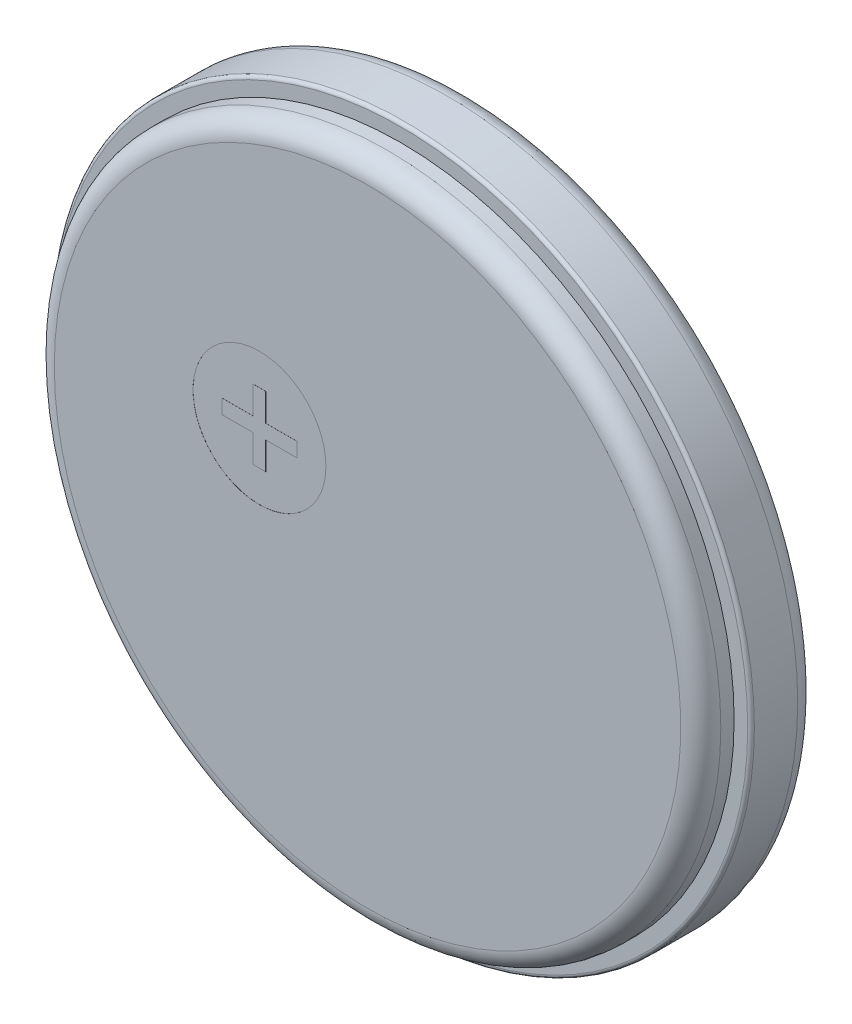
from build123d import *

# Parameters (mm, degrees)
SKETCH2_R           = 5
BOSS_EXTRUDE1_DEPTH = 0.5
FILLET1_R           = 0.3
SKETCH3_R           = 5.254
BOSS_EXTRUDE2_DEPTH = 1
FILLET2_R           = 0.3
FILLET3_R           = 0.05
SKETCH4_R           = 0.204240361
SKETCH4_W           = 0.21654249
SKETCH4_H           = 0.108271245
SKETCH4_H_2         = 0.688998832
SKETCH4_H_3         = 0.836641439
CUT_EXTRUDE1_DEPTH  = 0.001
CUT_EXTRUDE2_DEPTH  = 0.001
CUT_EXTRUDE3_DEPTH  = 0.001
SKETCH7_R           = 0.869118322
SKETCH7_W           = 1.218781041
SKETCH7_H           = 0.198406216
CUT_EXTRUDE4_DEPTH  = 0.001
SKETCH8_R           = 0.996942115
CUT_EXTRUDE5_DEPTH  = 0.001


with BuildPart() as part:
    # Sketch2 → Boss-Extrude1 (new body)
    with BuildSketch(Plane(origin=(0, 0, 10.668), x_dir=(-1, 0, 0), z_dir=(0, 0, -1))):
        with Locations((0, 31.75)):
            Circle(SKETCH2_R)
    extrude(amount=BOSS_EXTRUDE1_DEPTH)

    # Fillet1
    fillet1_edges = [part.edges().sort_by_distance(p)[0] for p in [
        (5, 31.75, 10.668),
    ]]
    fillet(fillet1_edges, radius=FILLET1_R)

    # Sketch3 → Boss-Extrude2 (add)
    with BuildSketch(Plane(origin=(0, 0, 10.168), x_dir=(-1, 0, 0), z_dir=(0, 0, -1))):
        with Locations((0, 31.75)):
            Circle(SKETCH3_R)
    extrude(amount=BOSS_EXTRUDE2_DEPTH)

    # Fillet2
    fillet2_edges = [part.edges().sort_by_distance(p)[0] for p in [
        (5.254, 31.75, 9.168),
    ]]
    fillet(fillet2_edges, radius=FILLET2_R)

    # Fillet3
    fillet3_edges = [part.edges().sort_by_distance(p)[0] for p in [
        (5.254, 31.75, 10.168),
    ]]
    fillet(fillet3_edges, radius=FILLET3_R)

    # Sketch4 → Cut-Extrude1 (cut)
    # profile 1 of 13: a face of its own
    with BuildSketch(Plane(origin=(0, 0, 9.168), x_dir=(-1, 0, 0), z_dir=(0, 0, -1))):
        with BuildLine():
            Line((1.141667618, 31.929914587), (0.581046776, 33.556913753))
            Line((0.581046776, 33.556913753), (0.722765501, 33.641944989))
            Line((0.722765501, 33.641944989), (1.648940943, 32.100139451))
            ThreePointArc((1.648940943, 32.100139451), (1.701014551, 32.132455468), (1.751501604, 32.167197993))
            Line((1.751501604, 32.167197993), (0.824646579, 33.71195637))
            Line((0.824646579, 33.71195637), (0.940237663, 33.78131102))
            Line((0.940237663, 33.78131102), (2.156604635, 32.649157947))
            ThreePointArc((2.156604635, 32.649157947), (0.24295512, 34.273823138), (1.141667618, 31.929914587))
        make_face()
        with Locations((0.581046776, 33.946951852)):
            Circle(SKETCH4_R, mode=Mode.SUBTRACT)
    # profile 2 of 13: a face of its own
    with BuildSketch(Plane(origin=(0, 0, 9.168), x_dir=(-1, 0, 0), z_dir=(0, 0, -1))):
        Polygon((-2.39422632, 30.765555813), (-2.39422632, 30.096242662), (-2.256426553, 30.096242662), (-2.256426553, 29.928914374), (-2.61076881, 29.928914374), (-2.61076881, 30.765555813), align=None)
    # profile 3 of 13: a face of its own
    with BuildSketch(Plane(origin=(0, 0, 9.168), x_dir=(-1, 0, 0), z_dir=(0, 0, -1))):
        with Locations((-2.098941106, 30.711420191)):
            Rectangle(SKETCH4_W, SKETCH4_H)
    # profile 4 of 13: a face of its own
    with BuildSketch(Plane(origin=(0, 0, 9.168), x_dir=(-1, 0, 0), z_dir=(0, 0, -1))):
        with Locations((-2.098941106, 30.27341379)):
            Rectangle(SKETCH4_W, SKETCH4_H_2)
    # profile 5 of 13: a face of its own
    with BuildSketch(Plane(origin=(0, 0, 9.168), x_dir=(-1, 0, 0), z_dir=(0, 0, -1))):
        with BuildLine():
            Line((-1.705227488, 30.70649877), (-1.705227488, 30.598227525))
            Line((-1.705227488, 30.598227525), (-1.636327605, 30.598227525))
            Line((-1.636327605, 30.598227525), (-1.636327605, 30.48995628))
            Line((-1.636327605, 30.48995628), (-1.705227488, 30.48995628))
            Line((-1.705227488, 30.48995628), (-1.705227488, 30.120849763))
            add(Edge.make_bspline(
                [(-1.705227488, 30.120849763), (-1.705179946, 30.115467168), (-1.705090741, 30.105367494), (-1.704909922, 30.091155884), (-1.704087812, 30.078851278), (-1.703150674, 30.068396215), (-1.702277967, 30.059770586), (-1.700674851, 30.053101016), (-1.699157307, 30.048205365), (-1.696998436, 30.044674265), (-1.693454652, 30.042695286), (-1.688757018, 30.041258916), (-1.682390647, 30.040120138), (-1.674436337, 30.039080915), (-1.664796502, 30.03813274), (-1.653507552, 30.037569394), (-1.640532618, 30.037303378), (-1.63135503, 30.037226445), (-1.626484764, 30.037185619)],
                knots=[0, 0, 0, 0, 1.739732428, 3.26436042, 4.592396978, 5.723406921, 6.6584426, 7.389883741, 7.934871935, 8.316298907, 8.688621296, 9.212551535, 9.90465525, 10.773969042, 11.805991926, 13.033823307, 14.425940557, 16, 16, 16, 16], degree=3))
            Line((-1.626484764, 30.037185619), (-1.626484764, 29.928914374))
            Line((-1.626484764, 29.928914374), (-1.714147562, 29.928914374))
            add(Edge.make_bspline(
                [(-1.714147562, 29.928914374), (-1.72009423, 29.928971109), (-1.731577482, 29.929080666), (-1.748138827, 29.929150415), (-1.763370933, 29.929581791), (-1.777255569, 29.930439398), (-1.789822074, 29.931151303), (-1.801116377, 29.932016366), (-1.811058854, 29.9332737), (-1.822495018, 29.935009102), (-1.835493184, 29.938426395), (-1.85011095, 29.944210693), (-1.863596403, 29.952283918), (-1.876146609, 29.961774326), (-1.886897812, 29.972882532), (-1.895755352, 29.984894046), (-1.902248806, 29.997727769), (-1.905940717, 30.009424757), (-1.907615621, 30.020190071), (-1.908882617, 30.030596118), (-1.909706319, 30.043381788), (-1.910418778, 30.058509911), (-1.91126972, 30.075934347), (-1.911694009, 30.095676678), (-1.911762064, 30.117773942), (-1.911870326, 30.133307142), (-1.911927137, 30.14145821)],
                knots=[0, 0, 0, 0, 1.195583195, 2.308718731, 3.329517598, 4.258521121, 5.105212991, 5.860114927, 6.535083728, 7.11964657, 8.184549345, 9.22951552, 10.268875888, 11.334626177, 12.384156653, 13.365429045, 14.324142953, 15.262984696, 15.817041888, 16.512473617, 17.370134424, 18.391765408, 19.557524602, 20.877102082, 22.361254963, 24, 24, 24, 24], degree=3))
            Line((-1.911927137, 30.14145821), (-1.911927137, 30.48995628))
            Line((-1.911927137, 30.48995628), (-1.951298499, 30.48995628))
            Line((-1.951298499, 30.48995628), (-1.951298499, 30.598227525))
            Line((-1.951298499, 30.598227525), (-1.911927137, 30.598227525))
            Line((-1.911927137, 30.598227525), (-1.911927137, 30.70649877))
            Line((-1.911927137, 30.70649877), (-1.705227488, 30.70649877))
        make_face()
    # profile 6 of 13: a face of its own
    with BuildSketch(Plane(origin=(0, 0, 9.168), x_dir=(-1, 0, 0), z_dir=(0, 0, -1))):
        with BuildLine():
            Line((-1.380413753, 30.765555813), (-1.380413753, 30.5770039))
            add(Edge.make_bspline(
                [(-1.380413753, 30.5770039), (-1.375866986, 30.58103327), (-1.366920207, 30.588961955), (-1.352499473, 30.599306103), (-1.337600849, 30.608122589), (-1.322073804, 30.615242258), (-1.306004962, 30.620817862), (-1.289362597, 30.624768391), (-1.272173261, 30.627374489), (-1.260515026, 30.627627761), (-1.254609948, 30.627756047)],
                knots=[0, 0, 0, 0, 1.04812943, 2.062428872, 3.058027074, 4.032076938, 5.005966002, 5.988978722, 6.981386338, 8, 8, 8, 8], degree=3))
            add(Edge.make_bspline(
                [(-1.254609948, 30.627756047), (-1.245712064, 30.627469604), (-1.228468331, 30.626914489), (-1.203660069, 30.621515584), (-1.180868884, 30.612800219), (-1.160778627, 30.600363838), (-1.143348244, 30.586202798), (-1.129366108, 30.570487245), (-1.119036955, 30.553670405), (-1.113774272, 30.538311181), (-1.111271581, 30.524852925), (-1.109353584, 30.51291951), (-1.108135402, 30.499038926), (-1.106824986, 30.483359526), (-1.106010198, 30.465762935), (-1.105134333, 30.446286808), (-1.10495573, 30.424901247), (-1.104862672, 30.410034264), (-1.10481422, 30.402293482)],
                knots=[0, 0, 0, 0, 1.355316654, 2.626548085, 3.851945391, 5.058719203, 6.213940796, 7.266439573, 8.251962698, 9.203916533, 9.722177574, 10.339188478, 11.046355066, 11.846282136, 12.738814704, 13.732522223, 14.819393942, 16, 16, 16, 16], degree=3))
            Line((-1.10481422, 30.402293482), (-1.10481422, 29.928914374))
            Line((-1.10481422, 29.928914374), (-1.311513869, 29.928914374))
            Line((-1.311513869, 29.928914374), (-1.311513869, 30.414904622))
            add(Edge.make_bspline(
                [(-1.311513869, 30.414904622), (-1.31155281, 30.41972364), (-1.311626971, 30.42890124), (-1.311923704, 30.441975906), (-1.312400337, 30.453715707), (-1.312921257, 30.464085713), (-1.3138841, 30.473108475), (-1.314934401, 30.480753377), (-1.316066566, 30.487113393), (-1.31804471, 30.493552268), (-1.321455262, 30.500113439), (-1.327863644, 30.505871054), (-1.336353666, 30.509166523), (-1.34260105, 30.509475597), (-1.345963811, 30.509641961)],
                knots=[0, 0, 0, 0, 1.530393892, 2.91456541, 4.152798705, 5.261743141, 6.211014231, 7.0329459, 7.713007905, 8.258808434, 9.169608314, 10.022710515, 10.935690215, 12, 12, 12, 12], degree=3))
            add(Edge.make_bspline(
                [(-1.345963811, 30.509641961), (-1.34913618, 30.509497046), (-1.355083694, 30.509225362), (-1.363111969, 30.505516186), (-1.369557772, 30.499829575), (-1.374056637, 30.491245107), (-1.3769267, 30.479600259), (-1.378870351, 30.464122704), (-1.380233928, 30.444353893), (-1.380349921, 30.429723086), (-1.380413753, 30.421671574)],
                knots=[0, 0, 0, 0, 0.714705951, 1.339921301, 1.966327435, 2.633377295, 3.503197372, 4.678559347, 6.172170647, 8, 8, 8, 8], degree=3))
            Line((-1.380413753, 30.421671574), (-1.380413753, 29.928914374))
            Line((-1.380413753, 29.928914374), (-1.587113402, 29.928914374))
            Line((-1.587113402, 29.928914374), (-1.587113402, 30.765555813))
            Line((-1.587113402, 30.765555813), (-1.380413753, 30.765555813))
        make_face()
    # profile 7 of 13: a face of its own
    with BuildSketch(Plane(origin=(0, 0, 9.168), x_dir=(-1, 0, 0), z_dir=(0, 0, -1))):
        with Locations((-0.917800251, 30.711420191)):
            Rectangle(SKETCH4_W, SKETCH4_H)
    # profile 8 of 13: a face of its own
    with BuildSketch(Plane(origin=(0, 0, 9.168), x_dir=(-1, 0, 0), z_dir=(0, 0, -1))):
        with Locations((-0.917800251, 30.27341379)):
            Rectangle(SKETCH4_W, SKETCH4_H_2)
    # profile 9 of 13: a face of its own
    with BuildSketch(Plane(origin=(0, 0, 9.168), x_dir=(-1, 0, 0), z_dir=(0, 0, -1))):
        with BuildLine():
            Line((-0.258329941, 30.617913206), (-0.258329941, 29.928914374))
            Line((-0.258329941, 29.928914374), (-0.468413067, 29.928914374))
            Line((-0.468413067, 29.928914374), (-0.46502959, 29.987817622))
            add(Edge.make_bspline(
                [(-0.46502959, 29.987817622), (-0.468628797, 29.982326947), (-0.475635823, 29.971637562), (-0.488351696, 29.957701636), (-0.502054709, 29.945703135), (-0.517098165, 29.93597093), (-0.533274694, 29.928318416), (-0.550671663, 29.92295733), (-0.569228033, 29.919654867), (-0.582001857, 29.919268753), (-0.588526479, 29.919071534)],
                knots=[0, 0, 0, 0, 1.061666706, 2.066879479, 3.043894156, 4.004116477, 4.958543322, 5.932696836, 6.944061519, 8, 8, 8, 8], degree=3))
            add(Edge.make_bspline(
                [(-0.588526479, 29.919071534), (-0.59587025, 29.919267939), (-0.609960643, 29.919644778), (-0.63012982, 29.922784035), (-0.648466538, 29.927700008), (-0.664693782, 29.935049779), (-0.679034188, 29.943901503), (-0.691012651, 29.954625908), (-0.701673375, 29.966098875), (-0.709629949, 29.979358119), (-0.716091944, 29.993227245), (-0.721067036, 30.007491681), (-0.725049605, 30.021952578), (-0.727146451, 30.034514519), (-0.728079986, 30.045690626), (-0.728876195, 30.055888185), (-0.729469353, 30.067939978), (-0.729873988, 30.08178561), (-0.730386723, 30.097470289), (-0.730663226, 30.115004648), (-0.730821884, 30.134383356), (-0.730798504, 30.147917537), (-0.730786283, 30.154992116)],
                knots=[0, 0, 0, 0, 1.372356562, 2.633121929, 3.807600132, 4.910298633, 5.952776581, 6.944670893, 7.908661259, 8.868831557, 9.820833315, 10.766735229, 11.689826756, 12.622720248, 13.142547126, 13.786556214, 14.535201573, 15.398368654, 16.376504451, 17.469410664, 18.677211821, 20, 20, 20, 20], degree=3))
            Line((-0.730786283, 30.154992116), (-0.730786283, 30.617913206))
            Line((-0.730786283, 30.617913206), (-0.524086633, 30.617913206))
            Line((-0.524086633, 30.617913206), (-0.524086633, 30.148071369))
            add(Edge.make_bspline(
                [(-0.524086633, 30.148071369), (-0.524119821, 30.141662956), (-0.524182486, 30.129562949), (-0.5237688, 30.112442446), (-0.523536765, 30.097418667), (-0.523076022, 30.084446725), (-0.522489012, 30.073521781), (-0.521746328, 30.064595951), (-0.520897928, 30.057698587), (-0.519602038, 30.051423795), (-0.516907122, 30.04541806), (-0.511133599, 30.040534885), (-0.503591336, 30.037541337), (-0.497922146, 30.037310221), (-0.4948657, 30.037185619)],
                knots=[0, 0, 0, 0, 1.812042913, 3.421398194, 4.842335651, 6.06080483, 7.091677302, 7.935583642, 8.593692084, 9.054393081, 9.748100288, 10.405409957, 11.140304508, 12, 12, 12, 12], degree=3))
            add(Edge.make_bspline(
                [(-0.4948657, 30.037185619), (-0.491609769, 30.037308768), (-0.485649969, 30.037534186), (-0.477622144, 30.040464767), (-0.471783831, 30.045669516), (-0.469107039, 30.051937073), (-0.468165379, 30.058445764), (-0.467125373, 30.06560699), (-0.466713725, 30.074969482), (-0.466012762, 30.086443648), (-0.465588414, 30.100085474), (-0.465343946, 30.115876881), (-0.464935311, 30.133869379), (-0.464997004, 30.146584425), (-0.46502959, 30.153300378)],
                knots=[0, 0, 0, 0, 0.876067957, 1.603593713, 2.260088472, 2.929160625, 3.393475713, 4.035657034, 4.88190587, 5.921621531, 7.140530935, 8.566649448, 10.186540624, 12, 12, 12, 12], degree=3))
            Line((-0.46502959, 30.153300378), (-0.46502959, 30.617913206))
            Line((-0.46502959, 30.617913206), (-0.258329941, 30.617913206))
        make_face()
    # profile 10 of 13: a face of its own
    with BuildSketch(Plane(origin=(0, 0, 9.168), x_dir=(-1, 0, 0), z_dir=(0, 0, -1))):
        with BuildLine():
            Line((0.017269592, 30.617913206), (0.017269592, 30.550858855))
            add(Edge.make_bspline(
                [(0.017269592, 30.550858855), (0.02142732, 30.556972329), (0.029569613, 30.56894466), (0.04400058, 30.584536608), (0.059300259, 30.598105668), (0.076083654, 30.608841528), (0.093907104, 30.617471146), (0.113024301, 30.623456283), (0.133300538, 30.627043577), (0.147211064, 30.627515524), (0.154300387, 30.627756047)],
                knots=[0, 0, 0, 0, 1.077223304, 2.1095822, 3.090370703, 4.052939172, 5.006340392, 5.971404446, 6.966152131, 8, 8, 8, 8], degree=3))
            add(Edge.make_bspline(
                [(0.154300387, 30.627756047), (0.161236005, 30.627515186), (0.174841235, 30.627042703), (0.194664193, 30.623462199), (0.213355318, 30.617432878), (0.230841497, 30.608847251), (0.247316533, 30.598044533), (0.26245744, 30.584585778), (0.276561416, 30.568880216), (0.284600289, 30.556961802), (0.288716677, 30.550858855)],
                knots=[0, 0, 0, 0, 1.025789608, 2.012236342, 2.969316882, 3.922572519, 4.886093681, 5.875074288, 6.911909806, 8, 8, 8, 8], degree=3))
            add(Edge.make_bspline(
                [(0.288716677, 30.550858855), (0.293217133, 30.556947669), (0.301967336, 30.568786104), (0.316642032, 30.584590133), (0.332223628, 30.597920789), (0.34870169, 30.608819688), (0.366072746, 30.617438374), (0.384471522, 30.623393244), (0.403764495, 30.627044768), (0.416913771, 30.62751642), (0.42359435, 30.627756047)],
                knots=[0, 0, 0, 0, 1.121403297, 2.180336103, 3.188108587, 4.153139269, 5.101063311, 6.052421157, 7.010519338, 8, 8, 8, 8], degree=3))
            add(Edge.make_bspline(
                [(0.42359435, 30.627756047), (0.432233837, 30.627510956), (0.44894773, 30.627036804), (0.472744404, 30.621993074), (0.494358112, 30.614018889), (0.513192729, 30.602545562), (0.529299672, 30.588916491), (0.542556142, 30.573691597), (0.552351077, 30.556802505), (0.558013586, 30.541453143), (0.560949123, 30.527995707), (0.562898402, 30.516385066), (0.564805292, 30.503376007), (0.566102589, 30.488843372), (0.567177395, 30.472896165), (0.56792668, 30.455460926), (0.568388162, 30.436592177), (0.568441204, 30.423517398), (0.568468658, 30.416750154)],
                knots=[0, 0, 0, 0, 1.396274718, 2.701223389, 3.916961255, 5.107873857, 6.249837686, 7.3206937, 8.358018463, 9.39218657, 9.953717558, 10.585231331, 11.297424592, 12.080859583, 12.945645179, 13.884064098, 14.904833943, 16, 16, 16, 16], degree=3))
            Line((0.568468658, 30.416750154), (0.568468658, 29.928914374))
            Line((0.568468658, 29.928914374), (0.361769008, 29.928914374))
            Line((0.361769008, 29.928914374), (0.361769008, 30.379070531))
            add(Edge.make_bspline(
                [(0.361769008, 30.379070531), (0.361712671, 30.3860938), (0.361605754, 30.399422674), (0.361531588, 30.418392724), (0.361123017, 30.435266467), (0.360246192, 30.450021126), (0.359626412, 30.462653649), (0.358512604, 30.473162118), (0.357360701, 30.481595953), (0.355661843, 30.489752012), (0.352620227, 30.497784867), (0.346340713, 30.504845784), (0.33777159, 30.5089662), (0.331467331, 30.509406139), (0.328088038, 30.509641961)],
                knots=[0, 0, 0, 0, 1.713054107, 3.251061448, 4.626981132, 5.828964419, 6.856173046, 7.710918569, 8.405859511, 8.930717602, 9.743458848, 10.46932057, 11.179504966, 12, 12, 12, 12], degree=3))
            add(Edge.make_bspline(
                [(0.328088038, 30.509641961), (0.324648628, 30.509481049), (0.318155182, 30.509177256), (0.309503067, 30.5048205), (0.302739432, 30.498003176), (0.299486259, 30.489923506), (0.297540893, 30.481823788), (0.296468141, 30.4733557), (0.295103979, 30.462871745), (0.294569695, 30.450172241), (0.293651042, 30.435421268), (0.293311115, 30.418545024), (0.292970761, 30.399526653), (0.292904276, 30.386145349), (0.292869125, 30.379070531)],
                knots=[0, 0, 0, 0, 0.826216397, 1.559858194, 2.289277558, 3.106944553, 3.631407287, 4.309815047, 5.173054605, 6.193999705, 7.388653756, 8.756183606, 10.284964305, 12, 12, 12, 12], degree=3))
            Line((0.292869125, 30.379070531), (0.292869125, 29.928914374))
            Line((0.292869125, 29.928914374), (0.086169475, 29.928914374))
            Line((0.086169475, 29.928914374), (0.086169475, 30.367535952))
            add(Edge.make_bspline(
                [(0.086169475, 30.367535952), (0.086108595, 30.375584355), (0.085993426, 30.390809716), (0.085976505, 30.412396086), (0.085391851, 30.431411882), (0.085055642, 30.447926704), (0.084300552, 30.461877629), (0.0833083, 30.473296723), (0.082575935, 30.482218301), (0.081023628, 30.490394499), (0.078286747, 30.498299372), (0.071968591, 30.505071801), (0.063407139, 30.509147722), (0.056996928, 30.509469623), (0.053565066, 30.509641961)],
                knots=[0, 0, 0, 0, 1.818527428, 3.440152716, 4.876833041, 6.116673496, 7.172292882, 8.032228621, 8.707612752, 9.19146093, 9.91415351, 10.561648488, 11.229943611, 12, 12, 12, 12], degree=3))
            add(Edge.make_bspline(
                [(0.053565066, 30.509641961), (0.051292937, 30.509541013), (0.046808839, 30.50934179), (0.04035612, 30.507213169), (0.034389561, 30.503803944), (0.029322904, 30.498954213), (0.024708551, 30.493511959), (0.021613788, 30.487057202), (0.019123064, 30.480234219), (0.018160097, 30.4720876), (0.017822154, 30.461664504), (0.017550384, 30.44750847), (0.017170882, 30.429055741), (0.01723456, 30.415263897), (0.017269592, 30.407676286)],
                knots=[0, 0, 0, 0, 0.672379664, 1.326956341, 1.99518974, 2.695410677, 3.398931448, 4.099978799, 4.807439054, 5.545658748, 6.520718531, 7.90594544, 9.747647403, 12, 12, 12, 12], degree=3))
            Line((0.017269592, 30.407676286), (0.017269592, 29.928914374))
            Line((0.017269592, 29.928914374), (-0.189430057, 29.928914374))
            Line((-0.189430057, 29.928914374), (-0.189430057, 30.617913206))
            Line((-0.189430057, 30.617913206), (0.017269592, 30.617913206))
        make_face()
    # profile 11 of 13: a face of its own
    with BuildSketch(Plane(origin=(0, 0, 9.168), x_dir=(-1, 0, 0), z_dir=(0, 0, -1))):
        with Locations((0.932653755, 30.347235094)):
            Rectangle(SKETCH4_W, SKETCH4_H_3)
    # profile 12 of 13: a face of its own
    with BuildSketch(Plane(origin=(0, 0, 9.168), x_dir=(-1, 0, 0), z_dir=(0, 0, -1))):
        with BuildLine():
            Line((1.582281225, 30.375225671), (1.582281225, 30.207743589))
            add(Edge.make_bspline(
                [(1.582281225, 30.207743589), (1.58226032, 30.200309678), (1.582219949, 30.185952995), (1.58167013, 30.165192993), (1.581211324, 30.145954639), (1.580000972, 30.128278378), (1.578935922, 30.112101876), (1.577141504, 30.097506025), (1.575385282, 30.084406879), (1.572542714, 30.06901073), (1.567631516, 30.050997221), (1.559125705, 30.030341455), (1.547673797, 30.010618133), (1.534136685, 29.991583972), (1.518158598, 29.974043053), (1.49958019, 29.959078609), (1.479097827, 29.946259955), (1.4563781, 29.936197823), (1.431725982, 29.928554349), (1.405354567, 29.923095342), (1.377264101, 29.919603981), (1.357957192, 29.91925207), (1.348052381, 29.919071534)],
                knots=[0, 0, 0, 0, 1.030820639, 1.990764312, 2.879836517, 3.698877591, 4.447479564, 5.127340947, 5.737592725, 6.27997261, 7.297519797, 8.320663796, 9.368189507, 10.453252059, 11.55504584, 12.646447391, 13.751149947, 14.896660089, 16.081551939, 17.323827552, 18.627072679, 20, 20, 20, 20], degree=3))
            add(Edge.make_bspline(
                [(1.348052381, 29.919071534), (1.337074262, 29.919217093), (1.315998253, 29.919496541), (1.285675083, 29.922487933), (1.257947025, 29.927163143), (1.232736461, 29.933622718), (1.210228643, 29.942328566), (1.190181329, 29.95266117), (1.172902928, 29.965260191), (1.158211203, 29.979756829), (1.146025445, 29.996173121), (1.135685199, 30.014099178), (1.127236966, 30.033615097), (1.121661277, 30.051089602), (1.11827247, 30.066352418), (1.115927081, 30.0792714), (1.114219596, 30.093615135), (1.11244201, 30.109235238), (1.111229348, 30.126268985), (1.110587524, 30.144634262), (1.109845395, 30.164368084), (1.109831872, 30.177957905), (1.109824883, 30.18498202)],
                knots=[0, 0, 0, 0, 1.566851768, 3.008072865, 4.344862402, 5.578649608, 6.716279408, 7.783554075, 8.789251884, 9.757031178, 10.718730646, 11.699157592, 12.705361265, 13.749293612, 14.312132592, 14.936642054, 15.622938965, 16.373791341, 17.180992382, 18.06001777, 18.997289313, 20, 20, 20, 20], degree=3))
            Line((1.109824883, 30.18498202), (1.109824883, 30.360307616))
            add(Edge.make_bspline(
                [(1.109824883, 30.360307616), (1.10988589, 30.368049085), (1.110004313, 30.383076467), (1.110861722, 30.40498827), (1.112649837, 30.425539572), (1.114652692, 30.444860948), (1.117672056, 30.462789548), (1.120931544, 30.479519909), (1.125111537, 30.494859902), (1.129850925, 30.509098296), (1.135654377, 30.52227237), (1.142184907, 30.53481327), (1.150053227, 30.546509544), (1.158508789, 30.557811222), (1.168425959, 30.568139145), (1.179099269, 30.577982555), (1.190913496, 30.587089332), (1.203614957, 30.595543198), (1.217390625, 30.603132644), (1.232143566, 30.609646294), (1.247699898, 30.615464604), (1.264315933, 30.619836927), (1.281781815, 30.623340961), (1.300206846, 30.625990861), (1.319522346, 30.627530588), (1.332721442, 30.627679996), (1.339439895, 30.627756047)],
                knots=[0, 0, 0, 0, 1.367165939, 2.653879496, 3.871100312, 5.009836591, 6.082946868, 7.080781523, 8.018528806, 8.888869268, 9.728143456, 10.558384481, 11.381984661, 12.214936081, 13.047543032, 13.906222177, 14.777268644, 15.678695825, 16.598484629, 17.550802427, 18.52460938, 19.528259021, 20.581129208, 21.669407874, 22.813708716, 24, 24, 24, 24], degree=3))
            add(Edge.make_bspline(
                [(1.339439895, 30.627756047), (1.350631152, 30.627573692), (1.372219922, 30.627221917), (1.403339055, 30.623015816), (1.432101588, 30.616848477), (1.458177699, 30.607422039), (1.48169365, 30.596317397), (1.502492272, 30.583482802), (1.520617808, 30.569209362), (1.535513719, 30.553025525), (1.547858973, 30.53608327), (1.558375702, 30.518920811), (1.566506003, 30.501355282), (1.571698838, 30.486247226), (1.574755341, 30.473504718), (1.576675416, 30.462860992), (1.578622411, 30.451142831), (1.579906168, 30.438194636), (1.580986159, 30.424093427), (1.581736962, 30.408810719), (1.582199846, 30.392402308), (1.582253535, 30.381070193), (1.582281225, 30.375225671)],
                knots=[0, 0, 0, 0, 1.658815711, 3.199979415, 4.649957207, 6.01364259, 7.3027161, 8.501301308, 9.631864061, 10.713282271, 11.752046223, 12.737947139, 13.693922422, 14.617315316, 15.102372854, 15.636288777, 16.22136206, 16.863764619, 17.565366476, 18.319134645, 19.133096068, 20, 20, 20, 20], degree=3))
        make_face()
        with BuildLine():
            add(Edge.make_bspline(
                [(1.375581575, 30.428746116), (1.375523222, 30.433000887), (1.375412843, 30.441049139), (1.3753639, 30.45253833), (1.374866802, 30.462740607), (1.37426974, 30.471768065), (1.373515385, 30.479512243), (1.372672253, 30.4861109), (1.371415579, 30.491374454), (1.369930492, 30.496745421), (1.366816992, 30.501952314), (1.361561026, 30.506769637), (1.354366931, 30.509102003), (1.349243113, 30.50945433), (1.346514437, 30.509641961)],
                knots=[0, 0, 0, 0, 1.585193112, 2.998524278, 4.279327145, 5.389603052, 6.36823621, 7.178467141, 7.864111684, 8.383615122, 9.248283339, 10.08726259, 10.981376477, 12, 12, 12, 12], degree=3))
            add(Edge.make_bspline(
                [(1.346514437, 30.509641961), (1.343725685, 30.509474323), (1.338582004, 30.509165124), (1.331408735, 30.506639532), (1.325897549, 30.502038903), (1.322710521, 30.496733478), (1.320934789, 30.491410303), (1.319807753, 30.486089312), (1.318659529, 30.479533797), (1.318063037, 30.471756087), (1.317165115, 30.462751111), (1.316765557, 30.452536276), (1.316686324, 30.441049749), (1.316580485, 30.433001098), (1.316524532, 30.428746116)],
                knots=[0, 0, 0, 0, 1.033270833, 1.905804199, 2.770216926, 3.641090693, 4.164334303, 4.847116915, 5.656874259, 6.631422529, 7.738535089, 9.013991789, 10.421423604, 12, 12, 12, 12], degree=3))
            Line((1.316524532, 30.428746116), (1.316524532, 30.116082137))
            add(Edge.make_bspline(
                [(1.316524532, 30.116082137), (1.316532645, 30.10859462), (1.316547328, 30.095042225), (1.317817358, 30.07682083), (1.31941659, 30.06284263), (1.321862487, 30.052590952), (1.325775492, 30.045344105), (1.331291201, 30.040511849), (1.338262856, 30.037614812), (1.343357989, 30.037334101), (1.346053054, 30.037185619)],
                knots=[0, 0, 0, 0, 1.905444241, 3.448851208, 4.646660283, 5.485608871, 6.116872217, 6.708589425, 7.316910003, 8, 8, 8, 8], degree=3))
            add(Edge.make_bspline(
                [(1.346053054, 30.037185619), (1.348842722, 30.037352851), (1.353988093, 30.0376613), (1.361081007, 30.040167377), (1.366537981, 30.044623829), (1.370370315, 30.051311676), (1.372833859, 30.060677046), (1.37447623, 30.073428082), (1.375494035, 30.090023952), (1.375550379, 30.102341545), (1.375581575, 30.10916139)],
                knots=[0, 0, 0, 0, 0.759541473, 1.400927311, 2.016662793, 2.637613118, 3.469132219, 4.641499325, 6.140509111, 8, 8, 8, 8], degree=3))
            Line((1.375581575, 30.10916139), (1.375581575, 30.428746116))
        make_face(mode=Mode.SUBTRACT)
    # profile 13 of 13: a face of its own
    with BuildSketch(Plane(origin=(0, 0, 9.168), x_dir=(-1, 0, 0), z_dir=(0, 0, -1))):
        with BuildLine():
            Line((1.867723598, 30.617913206), (1.867723598, 30.556395453))
            add(Edge.make_bspline(
                [(1.867723598, 30.556395453), (1.871478469, 30.56208945), (1.878795601, 30.573185364), (1.891924728, 30.587727162), (1.906092198, 30.600203554), (1.921673908, 30.610264583), (1.938399477, 30.618233659), (1.956398593, 30.623674909), (1.975546534, 30.627238318), (1.988742923, 30.627580264), (1.99552673, 30.627756047)],
                knots=[0, 0, 0, 0, 1.064995489, 2.075361174, 3.052501998, 4.00840857, 4.965658179, 5.939110672, 6.940568094, 8, 8, 8, 8], degree=3))
            add(Edge.make_bspline(
                [(1.99552673, 30.627756047), (2.003907106, 30.627499491), (2.019996979, 30.627006919), (2.042931452, 30.622187846), (2.063426188, 30.614127565), (2.081389165, 30.603037393), (2.096387001, 30.589345505), (2.109100263, 30.57424137), (2.11814408, 30.556950446), (2.123456093, 30.541302942), (2.126473716, 30.527498898), (2.128208362, 30.515404856), (2.129923793, 30.501773591), (2.131325955, 30.486542836), (2.132130888, 30.46971042), (2.132958114, 30.451258069), (2.13339483, 30.431157621), (2.133451116, 30.417211697), (2.13348029, 30.409983201)],
                knots=[0, 0, 0, 0, 1.346989573, 2.586147466, 3.748680099, 4.874797896, 5.961187435, 7.004645834, 8.034222122, 9.080187704, 9.654551372, 10.305482694, 11.045161036, 11.865103338, 12.765521689, 13.756168348, 14.836970039, 16, 16, 16, 16], degree=3))
            Line((2.13348029, 30.409983201), (2.13348029, 29.928914374))
            Line((2.13348029, 29.928914374), (1.926780641, 29.928914374))
            Line((1.926780641, 29.928914374), (1.926780641, 30.407061108))
            add(Edge.make_bspline(
                [(1.926780641, 30.407061108), (1.926813308, 30.412700592), (1.926875381, 30.423416646), (1.926460727, 30.438639968), (1.926232361, 30.452126598), (1.925759102, 30.463866869), (1.925200903, 30.47387327), (1.924371163, 30.482114593), (1.923754788, 30.488676702), (1.922379503, 30.494844772), (1.919945924, 30.501029724), (1.914444257, 30.506271883), (1.907058012, 30.509281956), (1.901588934, 30.509515743), (1.898636269, 30.509641961)],
                knots=[0, 0, 0, 0, 1.718959462, 3.26633864, 4.641861321, 5.830430957, 6.848101224, 7.695563669, 8.356528148, 8.853158932, 9.622694719, 10.341022558, 11.104345243, 12, 12, 12, 12], degree=3))
            add(Edge.make_bspline(
                [(1.898636269, 30.509641961), (1.895522184, 30.509487757), (1.889686089, 30.509198764), (1.881774701, 30.505638355), (1.875929338, 30.499585453), (1.873033628, 30.492681607), (1.871543883, 30.485692739), (1.870511772, 30.47839238), (1.869581635, 30.469212317), (1.86909497, 30.458120795), (1.868420646, 30.445207629), (1.867942122, 30.430389931), (1.867892594, 30.413674008), (1.867781856, 30.40188326), (1.867723598, 30.395680324)],
                knots=[0, 0, 0, 0, 0.856066547, 1.604351442, 2.335943869, 3.128797032, 3.637596973, 4.311011628, 5.165551894, 6.187484524, 7.379252524, 8.740395611, 10.285171094, 12, 12, 12, 12], degree=3))
            Line((1.867723598, 30.395680324), (1.867723598, 29.928914374))
            Line((1.867723598, 29.928914374), (1.661023948, 29.928914374))
            Line((1.661023948, 29.928914374), (1.661023948, 30.617913206))
            Line((1.661023948, 30.617913206), (1.867723598, 30.617913206))
        make_face()
    extrude(amount=-CUT_EXTRUDE1_DEPTH, mode=Mode.SUBTRACT)

    # Sketch5 → Cut-Extrude2 (cut)
    with BuildSketch(Plane(origin=(0, 0, 9.168), x_dir=(-1, 0, 0), z_dir=(0, 0, -1))):
        Polygon((-0.587410164, 31.431132867), (-0.883655405, 31.944796604), (-0.747356797, 31.944796604), (-0.539827474, 31.573450973), (-0.342044004, 31.944796604), (-0.223230601, 31.944796604), (-0.505000385, 31.431132867), align=None)
        Polygon((-0.193878387, 31.431132867), (-0.193878387, 31.853070937), (0.246404816, 31.853070937), (0.246404816, 31.779690403), (-0.092980153, 31.779690403), (-0.092980153, 31.687964736), (0.108816315, 31.687964736), (0.108816315, 31.614584202), (-0.092980153, 31.614584202), (-0.092980153, 31.504513401), (0.255577383, 31.504513401), (0.255577383, 31.431132867), align=None)
        Polygon((0.339964997, 31.431132867), (0.339964997, 31.853070937), (0.440863231, 31.853070937), (0.440863231, 31.504513401), (0.771075633, 31.504513401), (0.771075633, 31.431132867), align=None)
        Polygon((1.066432282, 31.779690403), (1.066432282, 31.431132867), (0.965534048, 31.431132867), (0.965534048, 31.779690403), (0.76373758, 31.779690403), (0.76373758, 31.853070937), (1.26822875, 31.853070937), (1.26822875, 31.779690403), align=None)
        Polygon((1.33427123, 31.431132867), (1.33427123, 31.853070937), (1.774554433, 31.853070937), (1.774554433, 31.779690403), (1.435169464, 31.779690403), (1.435169464, 31.687964736), (1.636965932, 31.687964736), (1.636965932, 31.614584202), (1.435169464, 31.614584202), (1.435169464, 31.504513401), (1.783727, 31.504513401), (1.783727, 31.431132867), align=None)
        Polygon((1.868114614, 31.431132867), (1.868114614, 31.853070937), (1.969012848, 31.853070937), (1.969012848, 31.504513401), (2.29922525, 31.504513401), (2.29922525, 31.431132867), align=None)
    extrude(amount=-CUT_EXTRUDE2_DEPTH, mode=Mode.SUBTRACT)

    # Sketch6 → Cut-Extrude3 (cut)
    # profile 1 of 6: a face of its own
    with BuildSketch(Plane(origin=(0, 0, 9.168), x_dir=(-1, 0, 0), z_dir=(0, 0, -1))):
        with BuildLine():
            Line((-0.931743202, 35.448684604), (-0.973296353, 35.416883723))
            add(Edge.make_bspline(
                [(-0.973296353, 35.416883723), (-0.976260577, 35.420416435), (-0.98214906, 35.42743423), (-0.991622535, 35.437288757), (-1.001495521, 35.446521243), (-1.011764245, 35.45517567), (-1.022613541, 35.462949395), (-1.03378059, 35.470247526), (-1.045452199, 35.476789196), (-1.061592045, 35.4847211), (-1.08270547, 35.492998197), (-1.109283975, 35.499938328), (-1.137029105, 35.504356292), (-1.15595779, 35.504834786), (-1.165585683, 35.505078167)],
                knots=[0, 0, 0, 0, 0.757959112, 1.505699292, 2.245454638, 2.979532153, 3.711538275, 4.438200793, 5.171680507, 5.909471876, 7.393775596, 8.890124382, 10.418191784, 12, 12, 12, 12], degree=3))
            add(Edge.make_bspline(
                [(-1.165585683, 35.505078167), (-1.170889944, 35.505017092), (-1.181449237, 35.504895508), (-1.197119899, 35.503291509), (-1.212497943, 35.501037076), (-1.227573367, 35.497691938), (-1.242326981, 35.493462745), (-1.256855237, 35.48840914), (-1.270947792, 35.482156682), (-1.284799597, 35.475246029), (-1.298070978, 35.467440451), (-1.31062811, 35.458926408), (-1.322425196, 35.449799176), (-1.333471567, 35.440024544), (-1.343778516, 35.429646534), (-1.35327136, 35.418554544), (-1.361917249, 35.406784037), (-1.369887561, 35.394490224), (-1.377025677, 35.381708915), (-1.383002218, 35.368392803), (-1.388294659, 35.354769921), (-1.392482521, 35.340686353), (-1.395797299, 35.326241196), (-1.398084458, 35.311395684), (-1.399670215, 35.29618083), (-1.399791194, 35.285868232), (-1.399852176, 35.280669947)],
                knots=[0, 0, 0, 0, 1.054917814, 2.100044995, 3.131103042, 4.146048494, 5.169673617, 6.183595914, 7.203665975, 8.234915748, 9.262203917, 10.264457458, 11.251630812, 12.227803204, 13.197192746, 14.159520551, 15.12972552, 16.100847026, 17.073214652, 18.039054194, 19.002613845, 19.979014051, 20.95965708, 21.949030935, 22.966165397, 24, 24, 24, 24], degree=3))
            add(Edge.make_bspline(
                [(-1.399852176, 35.280669947), (-1.399661401, 35.272848664), (-1.399286839, 35.257492613), (-1.395953341, 35.234999913), (-1.390887691, 35.213452145), (-1.383295574, 35.192984002), (-1.373934003, 35.173343095), (-1.362104768, 35.154861745), (-1.34840441, 35.137260669), (-1.332639111, 35.120955843), (-1.315342041, 35.106061506), (-1.296783726, 35.092945644), (-1.277010387, 35.082012322), (-1.256240349, 35.072914292), (-1.234313782, 35.065920716), (-1.211270115, 35.06099733), (-1.187159468, 35.057785715), (-1.170684333, 35.057478241), (-1.162299592, 35.057321757)],
                knots=[0, 0, 0, 0, 1.029171465, 2.020641659, 2.987623507, 3.938342917, 4.889210282, 5.84687017, 6.821220943, 7.821438502, 8.827599549, 9.822697543, 10.807740252, 11.797342354, 12.80366471, 13.83203677, 14.896651826, 16, 16, 16, 16], degree=3))
            add(Edge.make_bspline(
                [(-1.162299592, 35.057321757), (-1.153061447, 35.057577084), (-1.134878569, 35.05807963), (-1.108213403, 35.06233704), (-1.082687043, 35.069240082), (-1.058298116, 35.07890084), (-1.035115378, 35.09145952), (-1.01310255, 35.10668408), (-0.99224105, 35.12471934), (-0.979696582, 35.138490241), (-0.973296353, 35.145516201)],
                knots=[0, 0, 0, 0, 1.028121516, 2.023589091, 2.998037872, 3.967518031, 4.937445131, 5.927275754, 6.942489185, 8, 8, 8, 8], degree=3))
            Line((-0.973296353, 35.145516201), (-0.931743202, 35.114033329))
            add(Edge.make_bspline(
                [(-0.931743202, 35.114033329), (-0.935087249, 35.109718586), (-0.941759326, 35.10110977), (-0.952563098, 35.088973452), (-0.963944309, 35.07755796), (-0.975987493, 35.066955332), (-0.988554112, 35.056953407), (-1.001869807, 35.047836344), (-1.015759529, 35.039476889), (-1.030176218, 35.03182258), (-1.045104556, 35.02503152), (-1.060526655, 35.019217677), (-1.07637604, 35.014209509), (-1.092653435, 35.010089276), (-1.109392603, 35.00687329), (-1.126533139, 35.004723411), (-1.144112037, 35.003250526), (-1.155971632, 35.003116282), (-1.161981583, 35.003048252)],
                knots=[0, 0, 0, 0, 0.986787822, 1.968848986, 2.935600012, 3.899624008, 4.868462664, 5.837806735, 6.815139263, 7.798259679, 8.787526145, 9.778297419, 10.776456485, 11.791383307, 12.812564526, 13.85620153, 14.913611965, 16, 16, 16, 16], degree=3))
            add(Edge.make_bspline(
                [(-1.161981583, 35.003048252), (-1.167672947, 35.003087863), (-1.178926914, 35.003166189), (-1.195542559, 35.004435004), (-1.211718365, 35.006166096), (-1.2274081, 35.008772639), (-1.242697384, 35.01184851), (-1.257447615, 35.015971664), (-1.271803939, 35.020590407), (-1.285708676, 35.026018899), (-1.299173654, 35.03214456), (-1.312155445, 35.039067808), (-1.324648077, 35.046730423), (-1.336774373, 35.054963502), (-1.348355198, 35.064031499), (-1.359490909, 35.073808478), (-1.370243951, 35.084261487), (-1.376896737, 35.091799066), (-1.380241632, 35.095588817)],
                knots=[0, 0, 0, 0, 1.114604814, 2.203992996, 3.262667896, 4.300477797, 5.318619304, 6.316056647, 7.298880507, 8.271930387, 9.238335007, 10.195173496, 11.151986948, 12.108099108, 13.064862484, 14.031167946, 15.010108607, 16, 16, 16, 16], degree=3))
            add(Edge.make_bspline(
                [(-1.380241632, 35.095588817), (-1.385599164, 35.10217183), (-1.396249547, 35.115258381), (-1.409875692, 35.136468285), (-1.421539668, 35.158612883), (-1.430970313, 35.181808515), (-1.438342774, 35.206003132), (-1.443450169, 35.23120893), (-1.446769042, 35.257402369), (-1.447148574, 35.275218169), (-1.447341492, 35.284274047)],
                knots=[0, 0, 0, 0, 0.994628077, 1.977248131, 2.950237994, 3.925870899, 4.908910175, 5.911660606, 6.938484602, 8, 8, 8, 8], degree=3))
            add(Edge.make_bspline(
                [(-1.447341492, 35.284274047), (-1.447106362, 35.293792312), (-1.446643757, 35.312518904), (-1.442713441, 35.340001395), (-1.436390837, 35.366331428), (-1.427410593, 35.391459851), (-1.416025141, 35.415518834), (-1.401960403, 35.438324587), (-1.385379776, 35.460022961), (-1.366413298, 35.480284715), (-1.345614427, 35.498811498), (-1.323341225, 35.515110769), (-1.299637288, 35.528675203), (-1.274763756, 35.540013909), (-1.248534373, 35.548729202), (-1.221005102, 35.55483022), (-1.192227671, 35.558627689), (-1.172593709, 35.55910775), (-1.162617601, 35.559351671)],
                knots=[0, 0, 0, 0, 1.032925535, 2.032216505, 3.007276963, 3.968222605, 4.92396291, 5.891752235, 6.871517503, 7.883894988, 8.900124299, 9.891468569, 10.874487609, 11.85992873, 12.854644235, 13.869047385, 14.917252991, 16, 16, 16, 16], degree=3))
            add(Edge.make_bspline(
                [(-1.162617601, 35.559351671), (-1.156537555, 35.559278777), (-1.144502718, 35.559134489), (-1.126699639, 35.557727489), (-1.109366811, 35.555381979), (-1.092492293, 35.552189431), (-1.075993993, 35.548227133), (-1.059998004, 35.543065445), (-1.044410465, 35.537163494), (-1.029329682, 35.530366202), (-1.014828013, 35.522736111), (-1.000909975, 35.514357796), (-0.987686121, 35.505241645), (-0.975063402, 35.495465189), (-0.963252975, 35.484821597), (-0.951919513, 35.473603627), (-0.941447898, 35.461488156), (-0.934984022, 35.452960267), (-0.931743202, 35.448684604)],
                knots=[0, 0, 0, 0, 1.096760587, 2.17092713, 3.219439832, 4.250915756, 5.268269357, 6.278326846, 7.281116186, 8.274029601, 9.260640565, 10.235837813, 11.203064059, 12.156899882, 13.114053108, 14.069676657, 15.032185724, 16, 16, 16, 16], degree=3))
        make_face()
    # profile 2 of 6: a face of its own
    with BuildSketch(Plane(origin=(0, 0, 9.168), x_dir=(-1, 0, 0), z_dir=(0, 0, -1))):
        with BuildLine():
            Line((-0.823196193, 35.545783295), (-0.717299258, 35.545783295))
            add(Edge.make_bspline(
                [(-0.717299258, 35.545783295), (-0.710232444, 35.545759772), (-0.69666338, 35.545714605), (-0.677224326, 35.545462758), (-0.659561181, 35.544740921), (-0.643683182, 35.544119742), (-0.629590619, 35.542987032), (-0.617240278, 35.54190441), (-0.606689043, 35.540487202), (-0.600301873, 35.539171025), (-0.597409935, 35.538575095)],
                knots=[0, 0, 0, 0, 1.410062039, 2.707475311, 3.878576406, 4.937260626, 5.877586885, 6.699081471, 7.410979367, 8, 8, 8, 8], degree=3))
            add(Edge.make_bspline(
                [(-0.597409935, 35.538575095), (-0.593538457, 35.537618549), (-0.585878091, 35.535725861), (-0.574848736, 35.531725422), (-0.564338832, 35.527096026), (-0.554392037, 35.521658654), (-0.545058174, 35.515372943), (-0.536241, 35.508347406), (-0.527900508, 35.500620483), (-0.520373999, 35.491997358), (-0.513277262, 35.482950648), (-0.507291838, 35.473168056), (-0.50213224, 35.462938277), (-0.498024316, 35.452157275), (-0.494716575, 35.440929602), (-0.492384275, 35.429153558), (-0.490985583, 35.416882791), (-0.490843184, 35.408513203), (-0.490770979, 35.404269373)],
                knots=[0, 0, 0, 0, 1.027469482, 2.033020251, 3.019912614, 3.986113645, 4.951240523, 5.91722682, 6.890402269, 7.87763091, 8.8651537, 9.85103654, 10.82876324, 11.815024772, 12.821070561, 13.842952187, 14.906261191, 16, 16, 16, 16], degree=3))
            add(Edge.make_bspline(
                [(-0.490770979, 35.404269373), (-0.490993078, 35.397218589), (-0.49142645, 35.383460684), (-0.495467031, 35.363494337), (-0.502085624, 35.344869285), (-0.51120593, 35.327608982), (-0.522820304, 35.312049872), (-0.536778933, 35.298383696), (-0.553089605, 35.286947662), (-0.568273561, 35.279017297), (-0.581686303, 35.27393837), (-0.592728244, 35.270364777), (-0.604773133, 35.267603742), (-0.617705563, 35.265130246), (-0.631579354, 35.263262787), (-0.646361253, 35.261895028), (-0.662061802, 35.26104019), (-0.67284759, 35.260912887), (-0.67839618, 35.260847398)],
                knots=[0, 0, 0, 0, 1.260483769, 2.459530307, 3.627416485, 4.787058657, 5.939039949, 7.08810263, 8.267026773, 9.491475466, 10.141966685, 10.831826277, 11.566392101, 12.351337768, 13.187381173, 14.07005841, 15.007169909, 16, 16, 16, 16], degree=3))
            Line((-0.67839618, 35.260847398), (-0.483986791, 35.016616629))
            Line((-0.483986791, 35.016616629), (-0.542712419, 35.016616629))
            Line((-0.542712419, 35.016616629), (-0.737121807, 35.260847398))
            Line((-0.737121807, 35.260847398), (-0.775706877, 35.260847398))
            Line((-0.775706877, 35.260847398), (-0.775706877, 35.016616629))
            Line((-0.775706877, 35.016616629), (-0.823196193, 35.016616629))
            Line((-0.823196193, 35.016616629), (-0.823196193, 35.545783295))
        make_face()
        with BuildLine():
            Line((-0.775706877, 35.491509791), (-0.775706877, 35.315120902))
            Line((-0.775706877, 35.315120902), (-0.678820191, 35.314378881))
            add(Edge.make_bspline(
                [(-0.678820191, 35.314378881), (-0.674296566, 35.31437688), (-0.665528493, 35.314373001), (-0.652843512, 35.314976822), (-0.641032495, 35.315663729), (-0.630140619, 35.316714403), (-0.620163019, 35.318068476), (-0.611104681, 35.319762261), (-0.60295082, 35.321735608), (-0.59344116, 35.324789902), (-0.582822065, 35.329628907), (-0.571281476, 35.336669167), (-0.561453741, 35.34552426), (-0.553150684, 35.355650009), (-0.546478734, 35.366783108), (-0.541774887, 35.378790107), (-0.538790018, 35.391367884), (-0.538437964, 35.400012669), (-0.538260296, 35.404375376)],
                knots=[0, 0, 0, 0, 1.146690395, 2.22261258, 3.21895312, 4.145990853, 4.996080663, 5.770904154, 6.481378293, 7.121626537, 8.300444488, 9.431385265, 10.535395872, 11.636531494, 12.74115979, 13.810798291, 14.895190096, 16, 16, 16, 16], degree=3))
            add(Edge.make_bspline(
                [(-0.538260296, 35.404375376), (-0.538442045, 35.40863087), (-0.538802206, 35.417063706), (-0.541742674, 35.429409302), (-0.546715235, 35.441061091), (-0.553416336, 35.451971674), (-0.561580494, 35.461875517), (-0.571153544, 35.470349313), (-0.581873734, 35.477341791), (-0.591893308, 35.481810132), (-0.600848957, 35.484549681), (-0.608624632, 35.486477536), (-0.617410534, 35.488026402), (-0.627249323, 35.489267383), (-0.638098998, 35.490334023), (-0.650014418, 35.491052447), (-0.662916527, 35.491477876), (-0.671858979, 35.491498905), (-0.676488127, 35.491509791)],
                knots=[0, 0, 0, 0, 1.101028733, 2.181837193, 3.264309656, 4.369019818, 5.486613113, 6.575447106, 7.666700264, 8.788928104, 9.402425223, 10.0903467, 10.862060571, 11.710948788, 12.657782767, 13.684531032, 14.801375019, 16, 16, 16, 16], degree=3))
            Line((-0.676488127, 35.491509791), (-0.775706877, 35.491509791))
        make_face(mode=Mode.SUBTRACT)
    # profile 3 of 6: a face of its own
    with BuildSketch(Plane(origin=(0, 0, 9.168), x_dir=(-1, 0, 0), z_dir=(0, 0, -1))):
        with BuildLine():
            Line((-0.090503885, 35.545783295), (-0.090503885, 35.491509791))
            Line((-0.090503885, 35.491509791), (-0.270496874, 35.491509791))
            Line((-0.270496874, 35.491509791), (-0.299011664, 35.352327933))
            add(Edge.make_bspline(
                [(-0.299011664, 35.352327933), (-0.293409169, 35.353874653), (-0.282555221, 35.356871178), (-0.266535099, 35.360198241), (-0.251326516, 35.362203849), (-0.241457501, 35.362477702), (-0.236681937, 35.362610218)],
                knots=[0, 0, 0, 0, 1.100273476, 2.13160584, 3.095893838, 4, 4, 4, 4], degree=3))
            add(Edge.make_bspline(
                [(-0.236681937, 35.362610218), (-0.230772848, 35.362482321), (-0.219154102, 35.362230843), (-0.202154404, 35.359816051), (-0.185926693, 35.356015135), (-0.170504906, 35.350705247), (-0.155860513, 35.343915323), (-0.142128251, 35.335433546), (-0.129101995, 35.325525531), (-0.117015436, 35.314134083), (-0.106050451, 35.301597124), (-0.096409641, 35.288117303), (-0.088220773, 35.273825621), (-0.081634802, 35.258585529), (-0.076375742, 35.242565514), (-0.072875381, 35.225597016), (-0.070544521, 35.207839979), (-0.070284113, 35.195698693), (-0.070151321, 35.18950742)],
                knots=[0, 0, 0, 0, 1.052922333, 2.070308379, 3.05430497, 4.020497103, 4.973039431, 5.925935799, 6.892292201, 7.88610001, 8.88166317, 9.857072816, 10.836096531, 11.812156883, 12.81219415, 13.836441305, 14.89672472, 16, 16, 16, 16], degree=3))
            add(Edge.make_bspline(
                [(-0.070151321, 35.18950742), (-0.070251874, 35.185195132), (-0.070451621, 35.176628833), (-0.071467408, 35.163907031), (-0.073423165, 35.151454555), (-0.076049, 35.139269753), (-0.079457198, 35.127375693), (-0.083583043, 35.115738331), (-0.088632205, 35.104430099), (-0.09417052, 35.093343998), (-0.100406594, 35.082730652), (-0.107327869, 35.072805151), (-0.11464027, 35.063418599), (-0.122508432, 35.054671665), (-0.131005488, 35.046621828), (-0.14002853, 35.039221314), (-0.14950556, 35.03234497), (-0.159583198, 35.026271921), (-0.170036883, 35.020683474), (-0.181017578, 35.016098844), (-0.192275327, 35.011999991), (-0.203972159, 35.008732836), (-0.216081581, 35.006172795), (-0.228623553, 35.004434014), (-0.241532297, 35.003167576), (-0.250282447, 35.003088298), (-0.254702436, 35.003048252)],
                knots=[0, 0, 0, 0, 1.056347294, 2.098418968, 3.122841568, 4.141288669, 5.149314143, 6.15115421, 7.162517403, 8.180376062, 9.185164535, 10.17417709, 11.141909838, 12.097768115, 13.052685741, 14.0056014, 14.954263652, 15.917497458, 16.885230207, 17.854509472, 18.828990115, 19.81800267, 20.826176721, 21.857883937, 22.917946725, 24, 24, 24, 24], degree=3))
            add(Edge.make_bspline(
                [(-0.254702436, 35.003048252), (-0.25997508, 35.003152701), (-0.270348385, 35.00335819), (-0.285546137, 35.00550789), (-0.300168464, 35.00858672), (-0.314097658, 35.013218632), (-0.327458552, 35.019022425), (-0.340071272, 35.026357608), (-0.352258098, 35.034669925), (-0.363523608, 35.044479217), (-0.373979354, 35.055200992), (-0.383339028, 35.066836255), (-0.3916747, 35.079192968), (-0.398852883, 35.092331141), (-0.404975798, 35.106216253), (-0.409785921, 35.120900325), (-0.413668244, 35.136306636), (-0.41531069, 35.146913178), (-0.416144911, 35.152300389)],
                knots=[0, 0, 0, 0, 1.0467383, 2.05933395, 3.04377827, 4.011590433, 4.970194871, 5.932262533, 6.905835911, 7.896367577, 8.894135286, 9.877477877, 10.858688626, 11.851381753, 12.8477658, 13.868841284, 14.917554742, 16, 16, 16, 16], degree=3))
            Line((-0.416144911, 35.152300389), (-0.368655595, 35.152300389))
            add(Edge.make_bspline(
                [(-0.368655595, 35.152300389), (-0.36748711, 35.147254187), (-0.365241219, 35.137555108), (-0.36031154, 35.123928107), (-0.354284199, 35.111784605), (-0.347117113, 35.100963966), (-0.338567287, 35.09152832), (-0.328811052, 35.08311955), (-0.317872766, 35.075533548), (-0.305718075, 35.069210344), (-0.292895145, 35.063817568), (-0.279474388, 35.060226538), (-0.265821231, 35.057701522), (-0.256586763, 35.057448768), (-0.25194636, 35.057321757)],
                knots=[0, 0, 0, 0, 1.136247022, 2.183929868, 3.172523383, 4.106158343, 5.02341133, 5.958108904, 6.928429099, 7.938127109, 8.96079061, 9.975095812, 10.982467395, 12, 12, 12, 12], degree=3))
            add(Edge.make_bspline(
                [(-0.25194636, 35.057321757), (-0.247416928, 35.057445851), (-0.238498441, 35.057690192), (-0.225373386, 35.059570852), (-0.212701678, 35.062467295), (-0.200608351, 35.066801904), (-0.188881785, 35.072070093), (-0.177818608, 35.078830587), (-0.167098768, 35.086610852), (-0.157055467, 35.095524533), (-0.147857122, 35.105347332), (-0.139729708, 35.115851652), (-0.132959865, 35.127057413), (-0.127254827, 35.138770616), (-0.122922721, 35.151119636), (-0.11983224, 35.164046599), (-0.118017491, 35.177583436), (-0.117767849, 35.186816534), (-0.117640637, 35.191521476)],
                knots=[0, 0, 0, 0, 1.027316725, 2.022795036, 3.002884548, 3.971462791, 4.93288096, 5.914575861, 6.907176829, 7.935150275, 8.956128384, 9.956726525, 10.942570165, 11.921478529, 12.907843606, 13.90538589, 14.932640048, 16, 16, 16, 16], degree=3))
            add(Edge.make_bspline(
                [(-0.117640637, 35.191521476), (-0.117740193, 35.195766263), (-0.11793506, 35.204074828), (-0.119527182, 35.216230422), (-0.122296533, 35.227731941), (-0.126140382, 35.238634927), (-0.131020736, 35.248949662), (-0.136984643, 35.258686791), (-0.144144026, 35.267717978), (-0.152322204, 35.276047447), (-0.161281455, 35.283734708), (-0.171175926, 35.290287921), (-0.181798558, 35.295800918), (-0.193021366, 35.30055858), (-0.205111297, 35.303975597), (-0.217828931, 35.30654098), (-0.2313116, 35.308024969), (-0.240529787, 35.308230874), (-0.245268175, 35.308336714)],
                knots=[0, 0, 0, 0, 1.045622112, 2.046656509, 3.013763289, 3.955457236, 4.890082067, 5.820317437, 6.762574623, 7.722996705, 8.69280354, 9.665887285, 10.63943826, 11.638615906, 12.663482002, 13.728887084, 14.832589034, 16, 16, 16, 16], degree=3))
            add(Edge.make_bspline(
                [(-0.245268175, 35.308336714), (-0.249369811, 35.308248934), (-0.257838648, 35.308067691), (-0.270829361, 35.306733209), (-0.284480609, 35.304580363), (-0.298740063, 35.301619109), (-0.313650544, 35.297743934), (-0.329180588, 35.293100194), (-0.345362848, 35.287548178), (-0.356266361, 35.283355331), (-0.361871407, 35.281199962)],
                knots=[0, 0, 0, 0, 0.817624296, 1.688186739, 2.600797293, 3.572016777, 4.590301741, 5.671205678, 6.80286297, 8, 8, 8, 8], degree=3))
            Line((-0.361871407, 35.281199962), (-0.307597902, 35.545783295))
            Line((-0.307597902, 35.545783295), (-0.090503885, 35.545783295))
        make_face()
    # profile 4 of 6: a face of its own
    with BuildSketch(Plane(origin=(0, 0, 9.168), x_dir=(-1, 0, 0), z_dir=(0, 0, -1))):
        with BuildLine():
            Line((0.316547397, 35.545783295), (0.316547397, 35.491509791))
            Line((0.316547397, 35.491509791), (0.136554408, 35.491509791))
            Line((0.136554408, 35.491509791), (0.108039618, 35.352327933))
            add(Edge.make_bspline(
                [(0.108039618, 35.352327933), (0.113642113, 35.353874653), (0.124496061, 35.356871178), (0.140516183, 35.360198241), (0.155724766, 35.362203849), (0.165593781, 35.362477702), (0.170369345, 35.362610218)],
                knots=[0, 0, 0, 0, 1.100273476, 2.13160584, 3.095893838, 4, 4, 4, 4], degree=3))
            add(Edge.make_bspline(
                [(0.170369345, 35.362610218), (0.176278434, 35.362482321), (0.18789718, 35.362230843), (0.204896878, 35.359816051), (0.221124589, 35.356015135), (0.236546376, 35.350705247), (0.251190769, 35.343915323), (0.264923031, 35.335433546), (0.277949287, 35.325525531), (0.290035846, 35.314134083), (0.301000831, 35.301597124), (0.310641641, 35.288117303), (0.318830509, 35.273825621), (0.32541648, 35.258585529), (0.33067554, 35.242565514), (0.334175901, 35.225597016), (0.336506761, 35.207839979), (0.336767169, 35.195698693), (0.336899961, 35.18950742)],
                knots=[0, 0, 0, 0, 1.052922333, 2.070308379, 3.05430497, 4.020497103, 4.973039431, 5.925935799, 6.892292201, 7.88610001, 8.88166317, 9.857072816, 10.836096531, 11.812156883, 12.81219415, 13.836441305, 14.89672472, 16, 16, 16, 16], degree=3))
            add(Edge.make_bspline(
                [(0.336899961, 35.18950742), (0.336799408, 35.185195132), (0.336599661, 35.176628833), (0.335583874, 35.163907031), (0.333628117, 35.151454555), (0.331002283, 35.139269753), (0.327594084, 35.127375693), (0.323468239, 35.115738331), (0.318419077, 35.104430099), (0.312880762, 35.093343998), (0.306644688, 35.082730652), (0.299723413, 35.072805151), (0.292411012, 35.063418599), (0.28454285, 35.054671665), (0.276045795, 35.046621828), (0.267022752, 35.039221314), (0.257545722, 35.03234497), (0.247468084, 35.026271921), (0.237014399, 35.020683474), (0.226033704, 35.016098844), (0.214775956, 35.011999991), (0.203079123, 35.008732836), (0.190969701, 35.006172795), (0.178427729, 35.004434014), (0.165518985, 35.003167576), (0.156768835, 35.003088298), (0.152348846, 35.003048252)],
                knots=[0, 0, 0, 0, 1.056347294, 2.098418968, 3.122841568, 4.141288669, 5.149314143, 6.15115421, 7.162517403, 8.180376062, 9.185164535, 10.17417709, 11.141909838, 12.097768115, 13.052685741, 14.0056014, 14.954263652, 15.917497458, 16.885230207, 17.854509472, 18.828990115, 19.81800267, 20.826176721, 21.857883937, 22.917946725, 24, 24, 24, 24], degree=3))
            add(Edge.make_bspline(
                [(0.152348846, 35.003048252), (0.147076202, 35.003152701), (0.136702898, 35.00335819), (0.121505145, 35.00550789), (0.106882818, 35.00858672), (0.092953624, 35.013218632), (0.079592731, 35.019022425), (0.06698001, 35.026357608), (0.054793184, 35.034669925), (0.043527674, 35.044479217), (0.033071928, 35.055200992), (0.023712254, 35.066836255), (0.015376582, 35.079192968), (0.008198399, 35.092331141), (0.002075484, 35.106216253), (-0.002734639, 35.120900325), (-0.006616962, 35.136306636), (-0.008259408, 35.146913178), (-0.009093629, 35.152300389)],
                knots=[0, 0, 0, 0, 1.0467383, 2.05933395, 3.04377827, 4.011590433, 4.970194871, 5.932262533, 6.905835911, 7.896367577, 8.894135286, 9.877477877, 10.858688626, 11.851381753, 12.8477658, 13.868841284, 14.917554742, 16, 16, 16, 16], degree=3))
            Line((-0.009093629, 35.152300389), (0.038395687, 35.152300389))
            add(Edge.make_bspline(
                [(0.038395687, 35.152300389), (0.039564172, 35.147254187), (0.041810063, 35.137555108), (0.046739742, 35.123928107), (0.052767083, 35.111784605), (0.059934169, 35.100963966), (0.068483995, 35.09152832), (0.07824023, 35.08311955), (0.089178516, 35.075533548), (0.101333207, 35.069210344), (0.114156137, 35.063817568), (0.127576894, 35.060226538), (0.141230051, 35.057701522), (0.150464519, 35.057448768), (0.155104922, 35.057321757)],
                knots=[0, 0, 0, 0, 1.136247022, 2.183929868, 3.172523383, 4.106158343, 5.02341133, 5.958108904, 6.928429099, 7.938127109, 8.96079061, 9.975095812, 10.982467395, 12, 12, 12, 12], degree=3))
            add(Edge.make_bspline(
                [(0.155104922, 35.057321757), (0.159634354, 35.057445851), (0.168552841, 35.057690192), (0.181677896, 35.059570852), (0.194349604, 35.062467295), (0.206442931, 35.066801904), (0.218169497, 35.072070093), (0.229232674, 35.078830587), (0.239952514, 35.086610852), (0.249995815, 35.095524533), (0.259194161, 35.105347332), (0.267321574, 35.115851652), (0.274091417, 35.127057413), (0.279796455, 35.138770616), (0.284128561, 35.151119636), (0.287219042, 35.164046599), (0.289033791, 35.177583436), (0.289283433, 35.186816534), (0.289410645, 35.191521476)],
                knots=[0, 0, 0, 0, 1.027316725, 2.022795036, 3.002884548, 3.971462791, 4.93288096, 5.914575861, 6.907176829, 7.935150275, 8.956128384, 9.956726525, 10.942570165, 11.921478529, 12.907843606, 13.90538589, 14.932640048, 16, 16, 16, 16], degree=3))
            add(Edge.make_bspline(
                [(0.289410645, 35.191521476), (0.289311089, 35.195766263), (0.289116222, 35.204074828), (0.2875241, 35.216230422), (0.284754749, 35.227731941), (0.2809109, 35.238634927), (0.276030546, 35.248949662), (0.270066639, 35.258686791), (0.262907256, 35.267717978), (0.254729078, 35.276047447), (0.245769827, 35.283734708), (0.235875356, 35.290287921), (0.225252724, 35.295800918), (0.214029916, 35.30055858), (0.201939985, 35.303975597), (0.189222351, 35.30654098), (0.175739682, 35.308024969), (0.166521495, 35.308230874), (0.161783107, 35.308336714)],
                knots=[0, 0, 0, 0, 1.045622112, 2.046656509, 3.013763289, 3.955457236, 4.890082067, 5.820317437, 6.762574623, 7.722996705, 8.69280354, 9.665887285, 10.63943826, 11.638615906, 12.663482002, 13.728887084, 14.832589034, 16, 16, 16, 16], degree=3))
            add(Edge.make_bspline(
                [(0.161783107, 35.308336714), (0.157681472, 35.308248934), (0.149212634, 35.308067691), (0.136221921, 35.306733209), (0.122570673, 35.304580363), (0.108311219, 35.301619109), (0.093400738, 35.297743934), (0.077870694, 35.293100194), (0.061688434, 35.287548178), (0.050784921, 35.283355331), (0.045179875, 35.281199962)],
                knots=[0, 0, 0, 0, 0.817624296, 1.688186739, 2.600797293, 3.572016777, 4.590301741, 5.671205678, 6.80286297, 8, 8, 8, 8], degree=3))
            Line((0.045179875, 35.281199962), (0.09945338, 35.545783295))
            Line((0.09945338, 35.545783295), (0.316547397, 35.545783295))
        make_face()
    # profile 5 of 6: a face of its own
    with BuildSketch(Plane(origin=(0, 0, 9.168), x_dir=(-1, 0, 0), z_dir=(0, 0, -1))):
        with BuildLine():
            add(Edge.make_bspline(
                [(0.391173465, 35.280987956), (0.391223058, 35.289469347), (0.391319394, 35.305944571), (0.392391096, 35.329951296), (0.394171415, 35.352472673), (0.396611232, 35.37350978), (0.399580308, 35.393068046), (0.40354384, 35.411095206), (0.408051252, 35.427674694), (0.413275252, 35.442860575), (0.419169835, 35.456857442), (0.425585491, 35.46992411), (0.432776835, 35.482040807), (0.440332868, 35.493400925), (0.448559455, 35.503818507), (0.457222486, 35.513440672), (0.46666008, 35.522045035), (0.476551415, 35.529883702), (0.486986048, 35.53675523), (0.497666546, 35.542807799), (0.508666425, 35.547978493), (0.520015717, 35.552044071), (0.531612413, 35.555402139), (0.543497053, 35.557698563), (0.555689259, 35.559143477), (0.563918774, 35.559281615), (0.568092369, 35.559351671)],
                knots=[0, 0, 0, 0, 1.646270934, 3.197905019, 4.663502075, 6.030701355, 7.308322542, 8.50163776, 9.611534131, 10.641858119, 11.616356847, 12.558055219, 13.465016945, 14.349605745, 15.204443733, 16.039544428, 16.859896111, 17.680448484, 18.487036065, 19.28249412, 20.06191084, 20.843045899, 21.620316918, 22.403196591, 23.190181807, 24, 24, 24, 24], degree=3))
            add(Edge.make_bspline(
                [(0.568092369, 35.559351671), (0.572300828, 35.559277918), (0.580670129, 35.559131247), (0.593043615, 35.557721555), (0.605131245, 35.555382469), (0.616881487, 35.552068226), (0.62839086, 35.547956499), (0.639569341, 35.542802852), (0.650486364, 35.536803785), (0.660968443, 35.529754699), (0.671130653, 35.521895473), (0.680723381, 35.513011118), (0.6897475, 35.503191339), (0.698316266, 35.4925412), (0.706186577, 35.480856431), (0.713681607, 35.468340262), (0.720390237, 35.45477381), (0.726851313, 35.440383429), (0.732428274, 35.424770948), (0.737457813, 35.408024371), (0.741521657, 35.389945893), (0.744906702, 35.370630365), (0.747529085, 35.350006853), (0.74943902, 35.328119564), (0.750447927, 35.304954101), (0.750637928, 35.289115712), (0.750735431, 35.280987956)],
                knots=[0, 0, 0, 0, 0.810914788, 1.612654377, 2.396697861, 3.181598691, 3.963628158, 4.749916497, 5.551656086, 6.361998678, 7.18212741, 8.025565596, 8.878627764, 9.750805457, 10.657531673, 11.591944965, 12.560506719, 13.57287815, 14.630710178, 15.753379473, 16.941251878, 18.199788006, 19.531962791, 20.947069417, 22.433333509, 24, 24, 24, 24], degree=3))
            add(Edge.make_bspline(
                [(0.750735431, 35.280987956), (0.750636918, 35.272895651), (0.750444968, 35.257128124), (0.74945033, 35.234066894), (0.747491109, 35.212295761), (0.745040313, 35.191762512), (0.741645941, 35.17255261), (0.737472303, 35.154599581), (0.732838266, 35.137825894), (0.727118005, 35.122368964), (0.7208571, 35.108013168), (0.714045184, 35.094607539), (0.706747246, 35.082033588), (0.698796329, 35.070391959), (0.690321586, 35.059600186), (0.681141635, 35.04984876), (0.671515249, 35.040902718), (0.661323134, 35.032942293), (0.650677578, 35.02597471), (0.63979805, 35.019743568), (0.628491515, 35.014719101), (0.6170142, 35.010404875), (0.605201935, 35.007108854), (0.593069445, 35.004829831), (0.580678442, 35.003231468), (0.572302253, 35.003109536), (0.568092369, 35.003048252)],
                knots=[0, 0, 0, 0, 1.561518951, 3.042555995, 4.452378317, 5.7783523, 7.031515105, 8.214008947, 9.334062868, 10.386615937, 11.391082383, 12.354592575, 13.286541444, 14.194233754, 15.072674879, 15.931287219, 16.775624067, 17.606195743, 18.42308326, 19.229000347, 20.022332153, 20.807536673, 21.593273796, 22.3848459, 23.188221202, 24, 24, 24, 24], degree=3))
            add(Edge.make_bspline(
                [(0.568092369, 35.003048252), (0.56391889, 35.003118761), (0.555689603, 35.00325779), (0.543495725, 35.004696176), (0.531660165, 35.00700871), (0.52012452, 35.010246697), (0.508829606, 35.01421013), (0.497929334, 35.019373842), (0.487302506, 35.025320778), (0.476977473, 35.03209342), (0.467148253, 35.039852769), (0.457759536, 35.048434989), (0.449047182, 35.058054243), (0.440938217, 35.068558643), (0.433231421, 35.07985155), (0.426142194, 35.092087149), (0.419584934, 35.105216925), (0.413591216, 35.119325704), (0.408277072, 35.134619366), (0.403582955, 35.151272873), (0.399876647, 35.169433213), (0.396704224, 35.188954529), (0.394145419, 35.209920707), (0.392398515, 35.232343128), (0.391318816, 35.25620782), (0.3912228, 35.272577179), (0.391173465, 35.280987956)],
                knots=[0, 0, 0, 0, 0.810891512, 1.598919785, 2.382837074, 3.152667961, 3.926044502, 4.706494248, 5.493654104, 6.291793342, 7.103789334, 7.925228297, 8.761435821, 9.622817696, 10.50288917, 11.416980706, 12.369136599, 13.353924996, 14.394355917, 15.514179734, 16.714354668, 17.994756427, 19.357759367, 20.818452758, 22.365282078, 24, 24, 24, 24], degree=3))
        make_face()
        with BuildLine():
            add(Edge.make_bspline(
                [(0.438662781, 35.281199962), (0.438680841, 35.274132004), (0.43871589, 35.260414485), (0.43963153, 35.24048104), (0.440878886, 35.221889097), (0.442487749, 35.204615051), (0.444877005, 35.18871737), (0.447554102, 35.174086716), (0.450811968, 35.160800514), (0.454666572, 35.148767595), (0.459057007, 35.137783748), (0.463850632, 35.127563088), (0.469000288, 35.117984879), (0.474763541, 35.109135155), (0.481040223, 35.100985056), (0.487688561, 35.09339033), (0.494956678, 35.086617453), (0.505011411, 35.078494464), (0.518285401, 35.0701005), (0.535010161, 35.062791032), (0.552195748, 35.058197494), (0.563860282, 35.057613331), (0.569682413, 35.057321757)],
                knots=[0, 0, 0, 0, 1.459021318, 2.831673884, 4.118529203, 5.306027144, 6.411944654, 7.436330062, 8.375795394, 9.233974572, 10.042671642, 10.816086306, 11.563610507, 12.285937304, 12.993564865, 13.685989202, 14.367179055, 15.041617293, 16.353048772, 17.594441528, 18.799311195, 20, 20, 20, 20], degree=3))
            add(Edge.make_bspline(
                [(0.569682413, 35.057321757), (0.575542204, 35.057563326), (0.587249687, 35.058045966), (0.604354439, 35.062702442), (0.62095973, 35.069728193), (0.633972988, 35.078035733), (0.643873325, 35.085947278), (0.650966727, 35.092692588), (0.657477298, 35.100245439), (0.663652231, 35.108394499), (0.669315687, 35.117295458), (0.674465709, 35.126905514), (0.679165215, 35.137251354), (0.681842654, 35.144473684), (0.683211559, 35.148166275)],
                knots=[0, 0, 0, 0, 1.353760809, 2.704726607, 4.075137775, 5.516104923, 6.260822281, 7.007110065, 7.778089737, 8.566572457, 9.372053459, 10.217411131, 11.088608312, 12, 12, 12, 12], degree=3))
            add(Edge.make_bspline(
                [(0.683211559, 35.148166275), (0.684806886, 35.152887914), (0.688046084, 35.162474866), (0.692220721, 35.177346514), (0.695508418, 35.192949789), (0.698466213, 35.209191443), (0.700485068, 35.226191255), (0.702110035, 35.243896625), (0.703067174, 35.262320903), (0.703185821, 35.274838717), (0.703246115, 35.281199962)],
                knots=[0, 0, 0, 0, 0.884706709, 1.796334032, 2.740027952, 3.714592787, 4.726048262, 5.777819803, 6.87074269, 8, 8, 8, 8], degree=3))
            add(Edge.make_bspline(
                [(0.703246115, 35.281199962), (0.703162931, 35.287560178), (0.703000207, 35.300002121), (0.702378211, 35.318223322), (0.700772028, 35.335529757), (0.698988113, 35.351995984), (0.696357819, 35.367530851), (0.693521817, 35.382264409), (0.689711634, 35.396014128), (0.685641621, 35.408995279), (0.680983382, 35.421060378), (0.675855646, 35.432265677), (0.670379261, 35.442665272), (0.664431089, 35.452230631), (0.658081742, 35.461004599), (0.651163636, 35.468811258), (0.643951189, 35.475892561), (0.633849067, 35.483975593), (0.620623788, 35.492217242), (0.604167362, 35.499801827), (0.58704192, 35.504157366), (0.575464743, 35.504771455), (0.569682413, 35.505078167)],
                knots=[0, 0, 0, 0, 1.31362396, 2.569729283, 3.763502607, 4.902122613, 5.988968491, 7.01645872, 7.998833611, 8.933434873, 9.825090667, 10.667526885, 11.477055099, 12.250526234, 12.991942729, 13.710640831, 14.402115721, 15.076753259, 16.378508321, 17.609869233, 18.806226677, 20, 20, 20, 20], degree=3))
            add(Edge.make_bspline(
                [(0.569682413, 35.505078167), (0.56382974, 35.504771032), (0.552113732, 35.504156201), (0.534810291, 35.499818055), (0.518224038, 35.492256571), (0.505033731, 35.483948295), (0.494924563, 35.476035241), (0.487806109, 35.469173241), (0.481131628, 35.4616672), (0.474983059, 35.453442149), (0.469224322, 35.444602742), (0.463935526, 35.435079441), (0.459170406, 35.424823985), (0.454773101, 35.413845071), (0.450906739, 35.40181319), (0.447717533, 35.388543354), (0.444771276, 35.373959235), (0.442685563, 35.357975452), (0.4408314, 35.340697079), (0.439639815, 35.322058723), (0.438712827, 35.302091846), (0.438679797, 35.288303402), (0.438662781, 35.281199962)],
                knots=[0, 0, 0, 0, 1.207732386, 2.417664972, 3.655092373, 4.956220595, 5.625982001, 6.301752483, 6.994047911, 7.697131622, 8.419323945, 9.170223765, 9.943494443, 10.752040957, 11.610060368, 12.549350801, 13.567764191, 14.679664412, 15.874934091, 17.154273443, 18.533957287, 20, 20, 20, 20], degree=3))
        make_face(mode=Mode.SUBTRACT)
    # profile 6 of 6: a face of its own
    with BuildSketch(Plane(origin=(0, 0, 9.168), x_dir=(-1, 0, 0), z_dir=(0, 0, -1))):
        with BuildLine():
            Line((1.130649961, 35.545783295), (1.130649961, 35.491509791))
            Line((1.130649961, 35.491509791), (0.950656972, 35.491509791))
            Line((0.950656972, 35.491509791), (0.922142182, 35.352327933))
            add(Edge.make_bspline(
                [(0.922142182, 35.352327933), (0.927744677, 35.353874653), (0.938598626, 35.356871178), (0.954618747, 35.360198241), (0.969827331, 35.362203849), (0.979696345, 35.362477702), (0.984471909, 35.362610218)],
                knots=[0, 0, 0, 0, 1.100273476, 2.13160584, 3.095893838, 4, 4, 4, 4], degree=3))
            add(Edge.make_bspline(
                [(0.984471909, 35.362610218), (0.990380998, 35.362482321), (1.001999744, 35.362230843), (1.018999442, 35.359816051), (1.035227153, 35.356015135), (1.05064894, 35.350705247), (1.065293333, 35.343915323), (1.079025595, 35.335433546), (1.092051851, 35.325525531), (1.10413841, 35.314134083), (1.115103395, 35.301597124), (1.124744205, 35.288117303), (1.132933073, 35.273825621), (1.139519044, 35.258585529), (1.144778104, 35.242565514), (1.148278465, 35.225597016), (1.150609325, 35.207839979), (1.150869733, 35.195698693), (1.151002525, 35.18950742)],
                knots=[0, 0, 0, 0, 1.052922333, 2.070308379, 3.05430497, 4.020497103, 4.973039431, 5.925935799, 6.892292201, 7.88610001, 8.88166317, 9.857072816, 10.836096531, 11.812156883, 12.81219415, 13.836441305, 14.89672472, 16, 16, 16, 16], degree=3))
            add(Edge.make_bspline(
                [(1.151002525, 35.18950742), (1.150901972, 35.185195132), (1.150702225, 35.176628833), (1.149686438, 35.163907031), (1.147730681, 35.151454555), (1.145104847, 35.139269753), (1.141696648, 35.127375693), (1.137570803, 35.115738331), (1.132521641, 35.104430099), (1.126983326, 35.093343998), (1.120747252, 35.082730652), (1.113825977, 35.072805151), (1.106513576, 35.063418599), (1.098645414, 35.054671665), (1.090148359, 35.046621828), (1.081125316, 35.039221314), (1.071648286, 35.03234497), (1.061570648, 35.026271921), (1.051116963, 35.020683474), (1.040136268, 35.016098844), (1.02887852, 35.011999991), (1.017181687, 35.008732836), (1.005072266, 35.006172795), (0.992530294, 35.004434014), (0.979621549, 35.003167576), (0.970871399, 35.003088298), (0.96645141, 35.003048252)],
                knots=[0, 0, 0, 0, 1.056347294, 2.098418968, 3.122841568, 4.141288669, 5.149314143, 6.15115421, 7.162517403, 8.180376062, 9.185164535, 10.17417709, 11.141909838, 12.097768115, 13.052685741, 14.0056014, 14.954263652, 15.917497458, 16.885230207, 17.854509472, 18.828990115, 19.81800267, 20.826176721, 21.857883937, 22.917946725, 24, 24, 24, 24], degree=3))
            add(Edge.make_bspline(
                [(0.96645141, 35.003048252), (0.961178766, 35.003152701), (0.950805462, 35.00335819), (0.935607709, 35.00550789), (0.920985382, 35.00858672), (0.907056188, 35.013218632), (0.893695295, 35.019022425), (0.881082574, 35.026357608), (0.868895749, 35.034669925), (0.857630238, 35.044479217), (0.847174493, 35.055200992), (0.837814818, 35.066836255), (0.829479146, 35.079192968), (0.822300963, 35.092331141), (0.816178048, 35.106216253), (0.811367925, 35.120900325), (0.807485602, 35.136306636), (0.805843156, 35.146913178), (0.805008935, 35.152300389)],
                knots=[0, 0, 0, 0, 1.0467383, 2.05933395, 3.04377827, 4.011590433, 4.970194871, 5.932262533, 6.905835911, 7.896367577, 8.894135286, 9.877477877, 10.858688626, 11.851381753, 12.8477658, 13.868841284, 14.917554742, 16, 16, 16, 16], degree=3))
            Line((0.805008935, 35.152300389), (0.852498251, 35.152300389))
            add(Edge.make_bspline(
                [(0.852498251, 35.152300389), (0.853666736, 35.147254187), (0.855912627, 35.137555108), (0.860842306, 35.123928107), (0.866869647, 35.111784605), (0.874036733, 35.100963966), (0.882586559, 35.09152832), (0.892342794, 35.08311955), (0.903281081, 35.075533548), (0.915435771, 35.069210344), (0.928258701, 35.063817568), (0.941679458, 35.060226538), (0.955332615, 35.057701522), (0.964567083, 35.057448768), (0.969207486, 35.057321757)],
                knots=[0, 0, 0, 0, 1.136247022, 2.183929868, 3.172523383, 4.106158343, 5.02341133, 5.958108904, 6.928429099, 7.938127109, 8.96079061, 9.975095812, 10.982467395, 12, 12, 12, 12], degree=3))
            add(Edge.make_bspline(
                [(0.969207486, 35.057321757), (0.973736918, 35.057445851), (0.982655405, 35.057690192), (0.99578046, 35.059570852), (1.008452169, 35.062467295), (1.020545495, 35.066801904), (1.032272061, 35.072070093), (1.043335238, 35.078830587), (1.054055078, 35.086610852), (1.064098379, 35.095524533), (1.073296725, 35.105347332), (1.081424138, 35.115851652), (1.088193981, 35.127057413), (1.093899019, 35.138770616), (1.098231125, 35.151119636), (1.101321607, 35.164046599), (1.103136355, 35.177583436), (1.103385997, 35.186816534), (1.103513209, 35.191521476)],
                knots=[0, 0, 0, 0, 1.027316725, 2.022795036, 3.002884548, 3.971462791, 4.93288096, 5.914575861, 6.907176829, 7.935150275, 8.956128384, 9.956726525, 10.942570165, 11.921478529, 12.907843606, 13.90538589, 14.932640048, 16, 16, 16, 16], degree=3))
            add(Edge.make_bspline(
                [(1.103513209, 35.191521476), (1.103413653, 35.195766263), (1.103218786, 35.204074828), (1.101626665, 35.216230422), (1.098857313, 35.227731941), (1.095013464, 35.238634927), (1.09013311, 35.248949662), (1.084169203, 35.258686791), (1.077009821, 35.267717978), (1.068831642, 35.276047447), (1.059872391, 35.283734708), (1.04997792, 35.290287921), (1.039355288, 35.295800918), (1.02813248, 35.30055858), (1.016042549, 35.303975597), (1.003324915, 35.30654098), (0.989842246, 35.308024969), (0.980624059, 35.308230874), (0.975885671, 35.308336714)],
                knots=[0, 0, 0, 0, 1.045622112, 2.046656509, 3.013763289, 3.955457236, 4.890082067, 5.820317437, 6.762574623, 7.722996705, 8.69280354, 9.665887285, 10.63943826, 11.638615906, 12.663482002, 13.728887084, 14.832589034, 16, 16, 16, 16], degree=3))
            add(Edge.make_bspline(
                [(0.975885671, 35.308336714), (0.971784036, 35.308248934), (0.963315199, 35.308067691), (0.950324485, 35.306733209), (0.936673237, 35.304580363), (0.922413783, 35.301619109), (0.907503302, 35.297743934), (0.891973258, 35.293100194), (0.875790999, 35.287548178), (0.864887485, 35.283355331), (0.859282439, 35.281199962)],
                knots=[0, 0, 0, 0, 0.817624296, 1.688186739, 2.600797293, 3.572016777, 4.590301741, 5.671205678, 6.80286297, 8, 8, 8, 8], degree=3))
            Line((0.859282439, 35.281199962), (0.913555944, 35.545783295))
            Line((0.913555944, 35.545783295), (1.130649961, 35.545783295))
        make_face()
    extrude(amount=-CUT_EXTRUDE3_DEPTH, mode=Mode.SUBTRACT)

    # Sketch7 → Cut-Extrude4 (cut)
    with BuildSketch(Plane(origin=(0, 0, 9.168), x_dir=(-1, 0, 0), z_dir=(0, 0, -1))):
        with Locations((-1.913202798, 33.31599192)):
            Circle(SKETCH7_R)
        with Locations((-1.913202798, 33.31599192)):
            Rectangle(SKETCH7_W, SKETCH7_H, mode=Mode.SUBTRACT)
    extrude(amount=-CUT_EXTRUDE4_DEPTH, mode=Mode.SUBTRACT)

    # Sketch8 → Cut-Extrude5 (cut)
    with BuildSketch(Plane.XY.offset(10.668)):
        with Locations((-1.621214039, 32.481363072)):
            Circle(SKETCH8_R)
        Polygon((-1.714796582, 32.589086321), (-2.183423784, 32.589086321), (-2.183423784, 32.373639823), (-1.714796582, 32.373639823), (-1.714796582, 31.95851542), (-1.527631497, 31.95851542), (-1.527631497, 32.373639823), (-1.059004295, 32.373639823), (-1.059004295, 32.589086321), (-1.527631497, 32.589086321), (-1.527631497, 33.004210723), (-1.714796582, 33.004210723), align=None, mode=Mode.SUBTRACT)
    extrude(amount=-CUT_EXTRUDE5_DEPTH, mode=Mode.SUBTRACT)


solid = part.part
